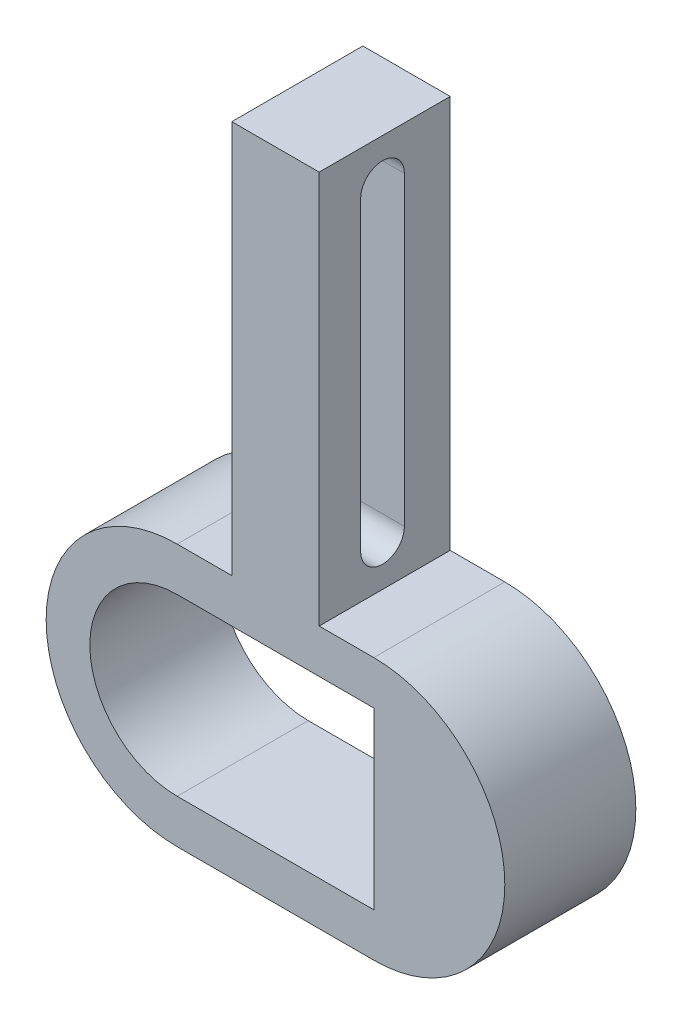
from build123d import *

# Parameters (mm, degrees)
SALIENTE_EXTRUIR1_DEPTH = 30
CORTAR_EXTRUIR1_DEPTH   = 30


with BuildPart() as part:
    # Croquis1 → Saliente-Extruir1 (new body)
    with BuildSketch(Plane.XY):
        with BuildLine():
            Line((0, 0), (20, 0))
            Line((20, 0), (20, -90))
            Line((20, -90), (32.5, -90))
            ThreePointArc((32.5, -90), (62.5, -120), (32.5, -150))
            Line((32.5, -150), (-12.5, -150))
            ThreePointArc((-12.5, -150), (-42.5, -120), (-12.5, -90))
            Line((-12.5, -90), (0, -90))
            Line((0, -90), (0, 0))
        make_face()
        with BuildLine():
            Line((32.5, -140), (-12.5, -140))
            ThreePointArc((-12.5, -140), (-32.5, -120), (-12.5, -100))
            Line((-12.5, -100), (32.5, -100))
            Line((32.5, -100), (32.5, -140))
        make_face(mode=Mode.SUBTRACT)
    extrude(amount=SALIENTE_EXTRUIR1_DEPTH)

    # Croquis3 → Cortar-Extruir1 (cut)
    with BuildSketch(Plane(origin=(20, 0, 0), x_dir=(0, 0, -1), z_dir=(1, 0, 0))):
        with BuildLine():
            Line((-10.497811767, -10), (-10.497811767, -80))
            ThreePointArc((-10.497811767, -80), (-15.497811767, -85), (-20.497811767, -80))
            Line((-20.497811767, -80), (-20.497811767, -10))
            ThreePointArc((-20.497811767, -10), (-15.497811767, -5), (-10.497811767, -10))
        make_face()
    extrude(amount=-CORTAR_EXTRUIR1_DEPTH, mode=Mode.SUBTRACT)


solid = part.part
